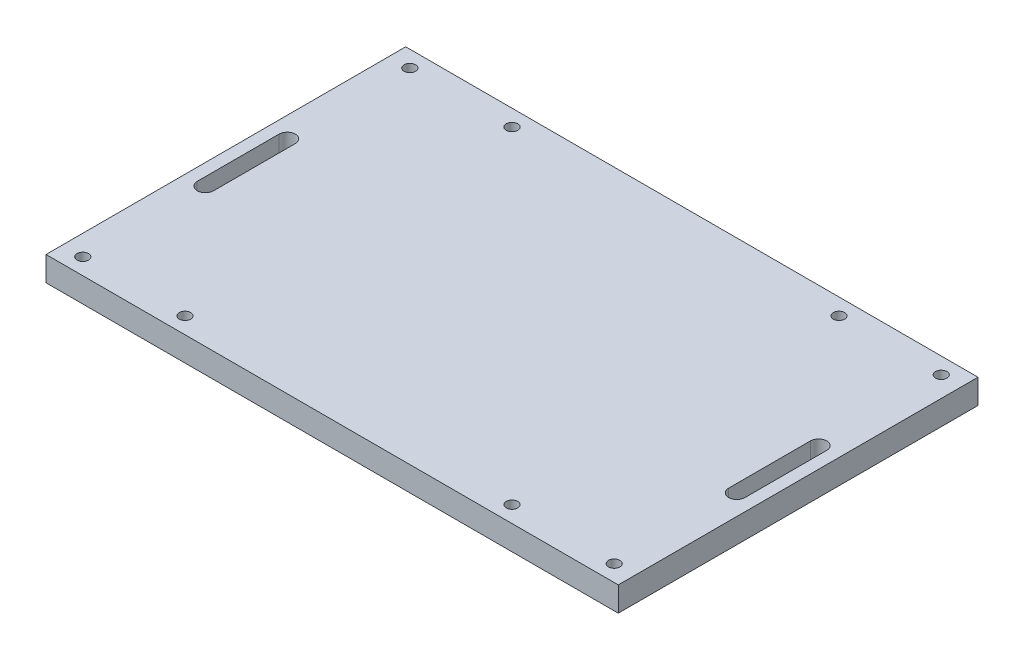
from build123d import *

# Parameters (mm, degrees)
SKETCH1_W               = 350
SKETCH1_H               = 220
BOSS_EXTRUDE1_DEPTH     = 7.5
SKETCH2_R               = 3.5
CUT_EXTRUDE1_DEPTH      = 208.243817761
MIRROR2_COPY_1_SKETCH_R = 3.5
MIRROR2_COPY_1_DEPTH    = 208.243817761
CUT_EXTRUDE2_DEPTH      = 208.243817761
SKETCH4_R               = 3.5
CUT_EXTRUDE5_DEPTH      = 208.243817761
MIRROR4_COPY_1_SKETCH_R = 3.5
MIRROR4_COPY_1_DEPTH    = 208.243817761


with BuildPart() as part:
    # Sketch1 → Boss-Extrude1 (new, symmetric)
    with BuildSketch(Plane(origin=(0, 0, 0), x_dir=(1, 0, 0), z_dir=(0, 1, 0))):
        Rectangle(SKETCH1_W, SKETCH1_H)
    extrude(amount=BOSS_EXTRUDE1_DEPTH, both=True)

    # Sketch2 → Cut-Extrude1 (cut, symmetric)
    with BuildSketch(Plane(origin=(0, 7.5, 0), x_dir=(1, 0, 0), z_dir=(0, 1, 0))):
        with Locations(Location((-100, 100, 0), (0, 0, 270))):
            Circle(SKETCH2_R)
    cut_extrude1 = extrude(amount=CUT_EXTRUDE1_DEPTH, both=True, mode=Mode.SUBTRACT)

    # Mirror1: Cut-Extrude1 across plane
    add(cut_extrude1.mirror(Plane.XY), mode=Mode.SUBTRACT)

    # Mirror2: Cut-Extrude1 across plane
    add(cut_extrude1.mirror(Plane(origin=(0, 0, 0), x_dir=(0, 0, 1), z_dir=(1, 0, 0))), mode=Mode.SUBTRACT)

    # Mirror2 copy 1 sketch → Mirror2 copy 1 (cut, symmetric)
    with BuildSketch(Plane(origin=(0, 7.5, 0), x_dir=(-1, 0, 0), z_dir=(0, 1, 0))):
        with Locations(Location((-100, 100, 0), (0, 0, 270))):
            Circle(MIRROR2_COPY_1_SKETCH_R)
    extrude(amount=MIRROR2_COPY_1_DEPTH, both=True, mode=Mode.SUBTRACT)

    # Sketch3 → Cut-Extrude2 (cut, symmetric)
    with BuildSketch(Plane(origin=(0, 7.5, 0), x_dir=(1, 0, 0), z_dir=(0, 1, 0))):
        with BuildLine():
            Line((-167.5, -25), (-167.5, 25))
            ThreePointArc((-167.5, 25), (-162.5, 30), (-157.5, 25))
            Line((-157.5, 25), (-157.5, -25))
            ThreePointArc((-157.5, -25), (-162.5, -30), (-167.5, -25))
        make_face()
    cut_extrude2 = extrude(amount=CUT_EXTRUDE2_DEPTH, both=True, mode=Mode.SUBTRACT)

    # Sketch4 → Cut-Extrude5 (cut, symmetric)
    with BuildSketch(Plane(origin=(0, 7.5, 0), x_dir=(1, 0, 0), z_dir=(0, 1, 0))):
        with Locations(Location((-162.5, 100, 0), (0, 0, 270))):
            Circle(SKETCH4_R)
    cut_extrude5 = extrude(amount=CUT_EXTRUDE5_DEPTH, both=True, mode=Mode.SUBTRACT)

    # Mirror3: Cut-Extrude5 across plane
    add(cut_extrude5.mirror(Plane.XY), mode=Mode.SUBTRACT)

    # Mirror4: Cut-Extrude5 across plane
    add(cut_extrude5.mirror(Plane(origin=(0, 0, 0), x_dir=(0, 0, 1), z_dir=(1, 0, 0))), mode=Mode.SUBTRACT)

    # Mirror4 copy 1 sketch → Mirror4 copy 1 (cut, symmetric)
    with BuildSketch(Plane(origin=(0, 7.5, 0), x_dir=(-1, 0, 0), z_dir=(0, 1, 0))):
        with Locations(Location((-162.5, 100, 0), (0, 0, 270))):
            Circle(MIRROR4_COPY_1_SKETCH_R)
    extrude(amount=MIRROR4_COPY_1_DEPTH, both=True, mode=Mode.SUBTRACT)

    # Mirror5: Cut-Extrude2 across plane
    add(cut_extrude2.mirror(Plane(origin=(0, 0, 0), x_dir=(0, 0, 1), z_dir=(1, 0, 0))), mode=Mode.SUBTRACT)


solid = part.part
